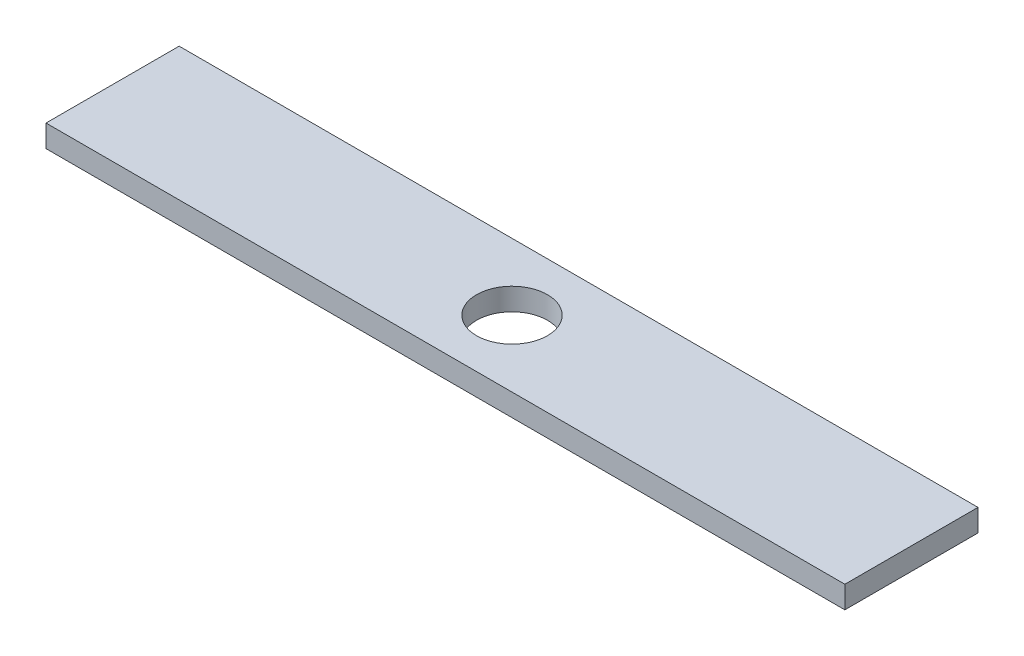
from build123d import *

# Parameters (mm, degrees)
SKETCH_1_W          = 180
SKETCH_1_H          = 30
EXTRUDE_1_DEPTH     = 5
SKETCH_2_R          = 8
CUT_EXTRUDE_1_DEPTH = 5


with BuildPart() as part:
    # 草图1 → 凸台-拉伸1 (new body)
    with BuildSketch(Plane(origin=(0, 0, 0), x_dir=(1, 0, 0), z_dir=(0, 1, 0))):
        Rectangle(SKETCH_1_W, SKETCH_1_H)
    extrude(amount=EXTRUDE_1_DEPTH)

    # 草图2 → 切除-拉伸1 (cut)
    with BuildSketch(Plane(origin=(0, 5, 0), x_dir=(1, 0, 0), z_dir=(0, 1, 0))):
        with Locations(Location((0, 0, 0), (0, 0, 270))):
            Circle(SKETCH_2_R)
    extrude(amount=-CUT_EXTRUDE_1_DEPTH, mode=Mode.SUBTRACT)


solid = part.part
